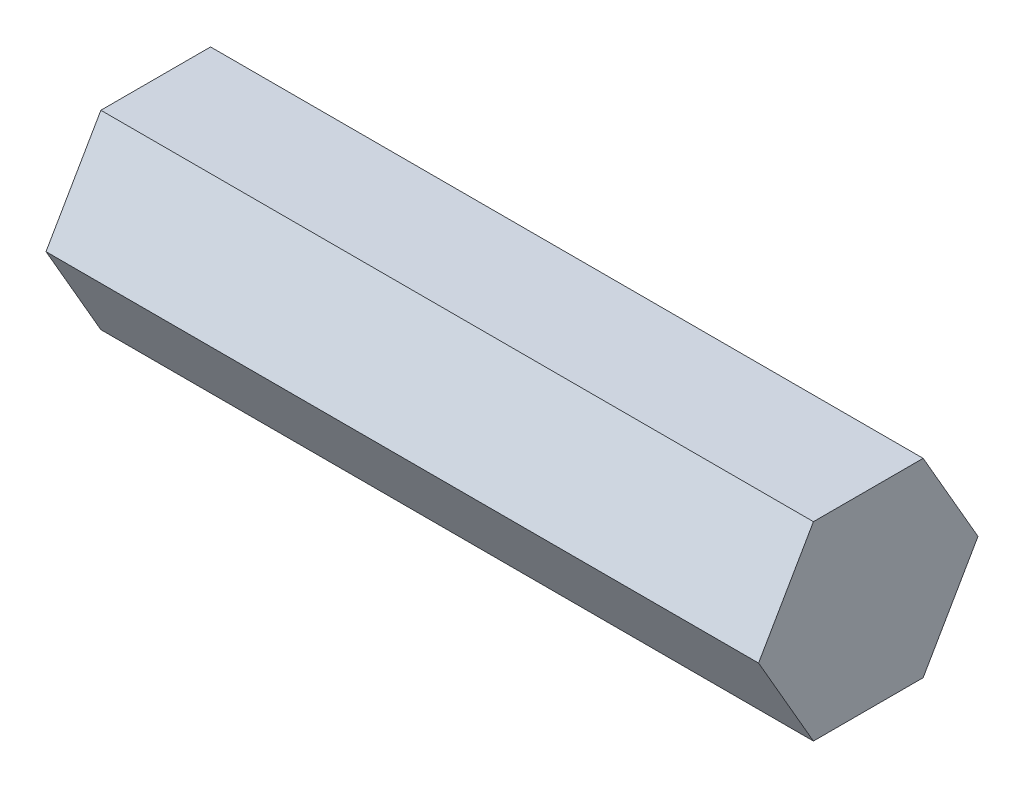
from build123d import *

# Parameters (mm, degrees)
SKETCH1_R           = 2
BOSS_EXTRUDE1_DEPTH = 15
BOSS_EXTRUDE2_DEPTH = 15


with BuildPart() as part:
    # Sketch1 → Boss-Extrude1 (new body)
    with BuildSketch(Plane(origin=(0, 0, 0), x_dir=(0, 0, -1), z_dir=(1, 0, 0))):
        Circle(SKETCH1_R)
    extrude(amount=BOSS_EXTRUDE1_DEPTH)

    # Sketch2 → Boss-Extrude2 (add, through all)
    with BuildSketch(Plane(origin=(15, 0, 0), x_dir=(0, 0, -1), z_dir=(1, 0, 0))):
        Polygon((2.309401077, 0), (1.154700538, 2), (-1.154700538, 2), (-2.309401077, 0), (-1.154700538, -2), (1.154700538, -2), align=None)
    extrude(amount=-BOSS_EXTRUDE2_DEPTH)


solid = part.part
